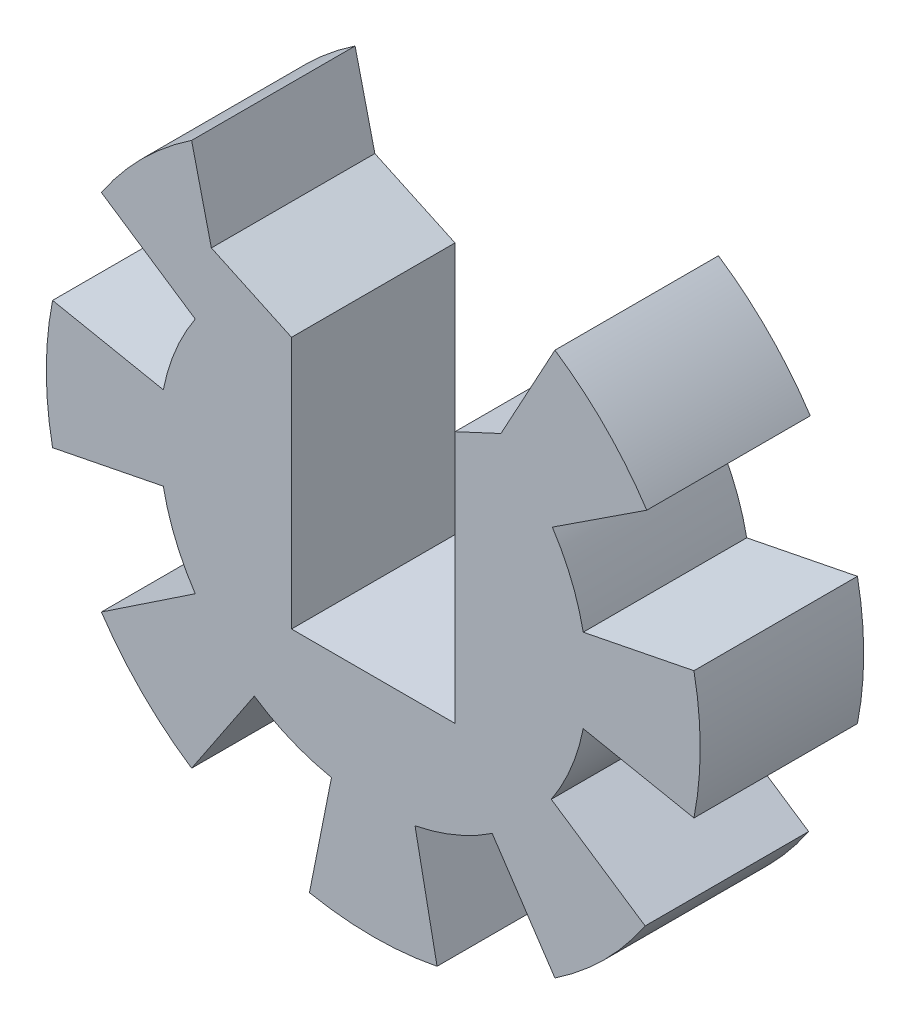
from build123d import *

# Parameters (mm, degrees)
RESSALTO_EXTRUS_O1_DEPTH = 6


with BuildPart() as part:
    # Esboço1 → Ressalto-extrusão1 (new body)
    with BuildSketch(Plane.XY):
        with BuildLine():
            Line((-3, -3.719131056), (3, -3.719131056))
            Line((3, -3.719131056), (3, 5.552723944))
            Line((3, 5.552723944), (4.686976687, 6.338438926))
            Line((4.686976687, 6.338438926), (6.666842796, 9.977635348))
            ThreePointArc((6.666842796, 9.977635348), (7.823592894, 9.098977648), (8.865699639, 8.08698769))
            ThreePointArc((8.865699639, 8.08698769), (9.481878586, 7.354860874), (10.037762914, 6.575965))
            Line((10.037762914, 6.575965), (6.572308916, 4.305667884))
            ThreePointArc((6.572308916, 4.305667884), (6.946088732, 3.672311498), (7.259013875, 3.006781996))
            ThreePointArc((7.259013875, 3.006781996), (7.518775912, 2.280795738), (7.706128027, 1.532844169))
            Line((7.706128027, 1.532844169), (11.769423365, 2.341083864))
            ThreePointArc((11.769423365, 2.341083864), (11.94221672, 1.176205684), (12, 0))
            ThreePointArc((12, 0), (11.94221672, -1.176205684), (11.769423365, -2.341083864))
            Line((11.769423365, -2.341083864), (7.706128027, -1.532844169))
            ThreePointArc((7.706128027, -1.532844169), (7.259013875, -3.006781996), (6.532939891, -4.365170878))
            Line((6.532939891, -4.365170878), (9.977635348, -6.666842796))
            ThreePointArc((9.977635348, -6.666842796), (9.27612544, -7.61271941), (8.485281374, -8.485281374))
            ThreePointArc((8.485281374, -8.485281374), (7.61271941, -9.27612544), (6.666842796, -9.977635348))
            Line((6.666842796, -9.977635348), (4.365170878, -6.532939891))
            ThreePointArc((4.365170878, -6.532939891), (3.006781996, -7.259013875), (1.532844169, -7.706128027))
            Line((1.532844169, -7.706128027), (2.341083864, -11.769423365))
            ThreePointArc((2.341083864, -11.769423365), (1.176205684, -11.94221672), (0, -12))
            ThreePointArc((0, -12), (-1.176205684, -11.94221672), (-2.341083864, -11.769423365))
            Line((-2.341083864, -11.769423365), (-1.532844169, -7.706128027))
            ThreePointArc((-1.532844169, -7.706128027), (-3.006781996, -7.259013875), (-4.365170878, -6.532939891))
            Line((-4.365170878, -6.532939891), (-6.666842796, -9.977635348))
            ThreePointArc((-6.666842796, -9.977635348), (-7.61271941, -9.27612544), (-8.485281374, -8.485281374))
            ThreePointArc((-8.485281374, -8.485281374), (-9.27612544, -7.61271941), (-9.977635348, -6.666842796))
            Line((-9.977635348, -6.666842796), (-6.532939891, -4.365170878))
            ThreePointArc((-6.532939891, -4.365170878), (-7.259013875, -3.006781996), (-7.706128027, -1.532844169))
            Line((-7.706128027, -1.532844169), (-11.769423365, -2.341083864))
            ThreePointArc((-11.769423365, -2.341083864), (-11.94221672, -1.176205684), (-12, 0))
            ThreePointArc((-12, 0), (-11.94221672, 1.176205684), (-11.769423365, 2.341083864))
            Line((-11.769423365, 2.341083864), (-7.706128027, 1.532844169))
            ThreePointArc((-7.706128027, 1.532844169), (-7.259013875, 3.006781996), (-6.532939891, 4.365170878))
            Line((-6.532939891, 4.365170878), (-9.977635348, 6.666842796))
            ThreePointArc((-9.977635348, 6.666842796), (-9.27612544, 7.61271941), (-8.485281374, 8.485281374))
            ThreePointArc((-8.485281374, 8.485281374), (-7.61271941, 9.27612544), (-6.666842796, 9.977635348))
            Line((-6.666842796, 9.977635348), (-5.941249609, 6.922620695))
            Line((-5.941249609, 6.922620695), (-3, 5.552723944))
            Line((-3, 5.552723944), (-3, -3.719131056))
        make_face()
    extrude(amount=RESSALTO_EXTRUS_O1_DEPTH)


solid = part.part
